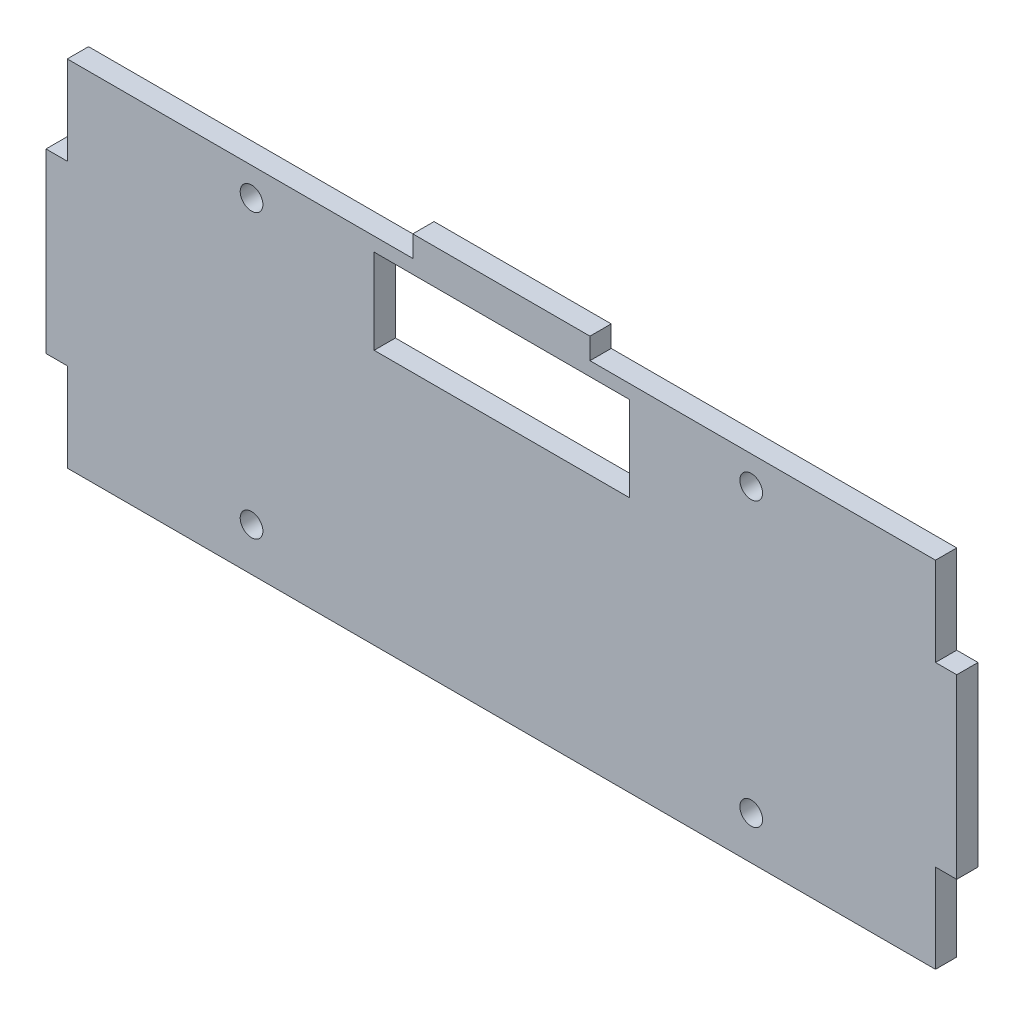
from build123d import *

# Parameters (mm, degrees)
BOSS_EXTRU_1_DEPTH      = 3
ESQUISSE3_W             = 36
ESQUISSE3_H             = 12
ENL_V_MAT_EXTRU_1_DEPTH = 4
SKETCH1_R               = 1.6
CUT_EXTRUDE1_DEPTH      = 71.150285103
SKETCH2_R               = 1.6
CUT_EXTRUDE2_DEPTH      = 71.150285103
SKETCH3_R               = 1.6
CUT_EXTRUDE3_DEPTH      = 71.150285103


with BuildPart() as part:
    # Esquisse1 → Boss.-Extru.1 (new body)
    with BuildSketch(Plane.XY):
        Polygon((61.25, -25), (-61.25, -25), (-61.25, -12.5), (-64.25, -12.5), (-64.25, 12.5), (-61.25, 12.5), (-61.25, 25), (-29.85, 25), (-26.65, 25), (-12.5, 25), (-12.5, 28), (12.5, 28), (12.5, 25), (26.65, 25), (29.85, 25), (61.25, 25), (61.25, 12.5), (64.25, 12.5), (64.25, -12.5), (61.25, -12.5), align=None)
    extrude(amount=BOSS_EXTRU_1_DEPTH)

    # Esquisse3 → Enlèv. mat.-Extru.1 (cut)
    with BuildSketch(Plane(origin=(0, 0, 0), x_dir=(-1, 0, 0), z_dir=(0, 0, -1))):
        with Locations((-0.047688523, 17.043645632)):
            Rectangle(ESQUISSE3_W, ESQUISSE3_H)
    extrude(amount=-ENL_V_MAT_EXTRU_1_DEPTH, mode=Mode.SUBTRACT)

    # Sketch1 → Cut-Extrude1 (cut, through all)
    with BuildSketch(Plane.XY.offset(3)):
        with Locations((35.25, 21)):
            Circle(SKETCH1_R)
    extrude(amount=-CUT_EXTRUDE1_DEPTH, mode=Mode.SUBTRACT)

    # Sketch2 → Cut-Extrude2 (cut, through all)
    with BuildSketch(Plane.XY.offset(3)):
        with Locations((-35.25, 21)):
            Circle(SKETCH2_R)
    extrude(amount=-CUT_EXTRUDE2_DEPTH, mode=Mode.SUBTRACT)

    # Sketch3 → Cut-Extrude3 (cut, through all)
    with BuildSketch(Plane.XY.offset(3)):
        with Locations((-35.25, -18.9)):
            Circle(SKETCH3_R)
        with Locations((35.25, -18.9)):
            Circle(SKETCH3_R)
    extrude(amount=-CUT_EXTRUDE3_DEPTH, mode=Mode.SUBTRACT)


solid = part.part
